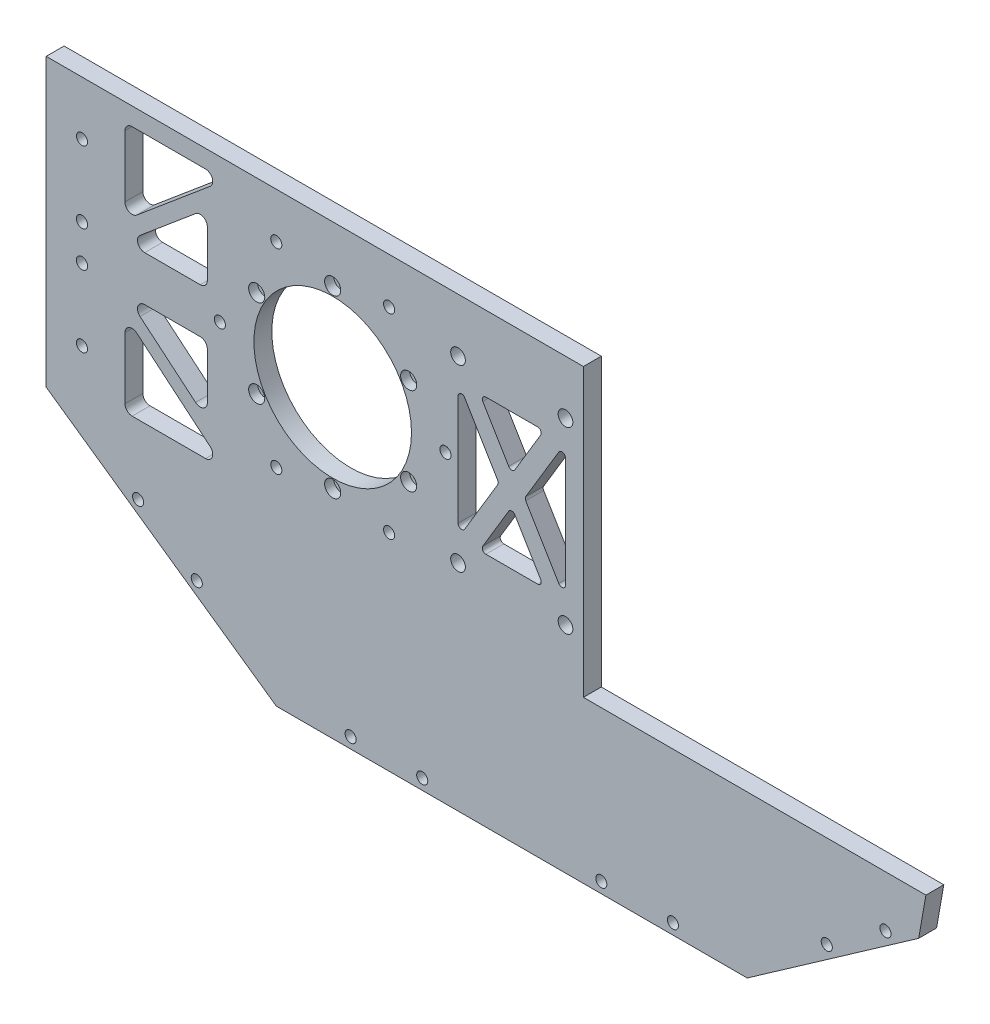
from build123d import *

# Parameters (mm, degrees)
SKETCH_1_W             = 150
SKETCH_1_H             = 80
SKETCH_1_R             = 1.3
SKETCH_1_R_2           = 22
EXTRUDE_1_DEPTH        = 5
SKETCH_3_R             = 1.55
SKETCH_3_R_2           = 1.582849294
CUT_EXTRUDE_3_DEPTH    = 12.5
CUT_EXTRUDE_5_DEPTH    = 8
FILLET_3_R             = 2
FILLET_3_OF_MIRROR_2_R = 2
EXTRUDE_4_DEPTH        = 5
FILLET_5_R             = 5
SKETCH_11_R            = 1.55
CUT_EXTRUDE_7_DEPTH    = 25
SKETCH_12_R            = 2.05
CUT_EXTRUDE_8_DEPTH    = 10
CUT_EXTRUDE_9_DEPTH    = 10
FILLET_6_R             = 1
EXTRUDE_5_DEPTH        = 5
CHAMFER_1_SIZE         = 20
CHAMFER_1_SIZE2        = 14.360300861
SKETCH_16_R            = 1.55
CUT_EXTRUDE_11_DEPTH   = 10.5
SKETCH_17_R            = 2.25
CUT_EXTRUDE_12_DEPTH   = 2.5
CUT_EXTRUDE_13_DEPTH   = 10
SKETCH_19_R            = 1.55
CUT_EXTRUDE_14_DEPTH   = 13


with BuildPart() as part:
    # 草图1 → 凸台-拉伸1 (new body)
    with BuildSketch(Plane.XY):
        with Locations((-5, 0)):
            Rectangle(SKETCH_1_W, SKETCH_1_H)
        with Locations((0, -24.5)):
            Circle(SKETCH_1_R, mode=Mode.SUBTRACT)
        with Locations((-21.217622393, -12.25)):
            Circle(SKETCH_1_R, mode=Mode.SUBTRACT)
        with Locations((-21.217622393, 12.25)):
            Circle(SKETCH_1_R, mode=Mode.SUBTRACT)
        Circle(SKETCH_1_R_2, mode=Mode.SUBTRACT)
        with Locations((0, 24.5)):
            Circle(SKETCH_1_R, mode=Mode.SUBTRACT)
        with Locations((21.217622393, 12.25)):
            Circle(SKETCH_1_R, mode=Mode.SUBTRACT)
        with Locations((21.217622393, -12.25)):
            Circle(SKETCH_1_R, mode=Mode.SUBTRACT)
    extrude(amount=EXTRUDE_1_DEPTH)

    # 草图3 → 切除-拉伸3 (cut)
    with BuildSketch(Plane.XY.offset(5)):
        with Locations((-70, -25)):
            Circle(SKETCH_3_R)
        with Locations((-70, -5)):
            Circle(SKETCH_3_R_2)
        with Locations((-70, 25)):
            Circle(SKETCH_3_R)
        with Locations((-70, 5)):
            Circle(SKETCH_3_R_2)
    extrude(amount=-CUT_EXTRUDE_3_DEPTH, mode=Mode.SUBTRACT)

    # 草图4 → 切除-拉伸5 (cut)
    with BuildSketch(Plane.XY.offset(5)):
        Polygon((-58, 35), (-30, 35), (-58, 11.505210327), align=None)
        Polygon((-35, 25.582872687), (-58, 6.28358117), (-35, 6.28358117), align=None)
    cut_extrude_5 = extrude(amount=-CUT_EXTRUDE_5_DEPTH, mode=Mode.SUBTRACT)

    # 圆角3
    fillet_3_edges = [part.edges().sort_by_distance(p)[0] for p in [
        (-35, 6.28358117, 2.5),
        (-58, 6.28358117, 2.5),
        (-35, 25.582872687, 2.5),
        (-30, 35, 2.5),
        (-58, 11.505210327, 2.5),
        (-58, 35, 2.5),
    ]]
    fillet(fillet_3_edges, radius=FILLET_3_R)

    # 镜向2: 切除-拉伸5 across plane
    add(cut_extrude_5.mirror(Plane.ZX), mode=Mode.SUBTRACT)

    # 圆角3 of 镜向2
    fillet_3_of_mirror_2_edges = [part.edges().sort_by_distance(p)[0] for p in [
        (-35, -6.28358117, 2.5),
        (-58, -6.28358117, 2.5),
        (-35, -25.582872687, 2.5),
        (-30, -35, 2.5),
        (-58, -11.505210327, 2.5),
        (-58, -35, 2.5),
    ]]
    fillet(fillet_3_of_mirror_2_edges, radius=FILLET_3_OF_MIRROR_2_R)

    # 草图10 → 凸台-拉伸4 (add)
    with BuildSketch(Plane.XY.offset(5)):
        Polygon((-80, -40), (-127.053079228, -7.053079228), (-80, 40), align=None)
    extrude(amount=-EXTRUDE_4_DEPTH)

    # 圆角5
    fillet_5_edges = [part.edges().sort_by_distance(p)[0] for p in [
        (-127.053079228, -7.053079228, 2.5),
    ]]
    fillet(fillet_5_edges, radius=FILLET_5_R)

    # 草图11 → 切除-拉伸7 (cut)
    with BuildSketch(Plane.XY.offset(5)):
        with Locations((-15.75, 27.279800219)):
            Circle(SKETCH_11_R)
        with Locations((15.75, 27.279800219)):
            Circle(SKETCH_11_R)
        with Locations((31.5, 0)):
            Circle(SKETCH_11_R)
        with Locations((15.75, -27.279800219)):
            Circle(SKETCH_11_R)
        with Locations((-15.75, -27.279800219)):
            Circle(SKETCH_11_R)
        with Locations((-31.5, 0)):
            Circle(SKETCH_11_R)
    extrude(amount=-CUT_EXTRUDE_7_DEPTH, mode=Mode.SUBTRACT)

    # 草图12 → 切除-拉伸8 (cut)
    with BuildSketch(Plane.XY.offset(5)):
        with Locations((35, 25)):
            Circle(SKETCH_12_R)
        with Locations((65, 25)):
            Circle(SKETCH_12_R)
        with Locations((65, -25)):
            Circle(SKETCH_12_R)
        with Locations((35, -25)):
            Circle(SKETCH_12_R)
    extrude(amount=-CUT_EXTRUDE_8_DEPTH, mode=Mode.SUBTRACT)

    # 草图13 → 切除-拉伸9 (cut)
    with BuildSketch(Plane.XY.offset(5)):
        Polygon((35, 19), (35, -19), (46.4, 0), align=None)
        Polygon((65, -19), (53.6, 0), (65, 19), align=None)
        Polygon((41, 19), (50, 4), (59, 19), align=None)
        Polygon((50, -4), (59, -19), (41, -19), align=None)
    extrude(amount=-CUT_EXTRUDE_9_DEPTH, mode=Mode.SUBTRACT)

    # 圆角6
    fillet_6_edges = [part.edges().sort_by_distance(p)[0] for p in [
        (41, 19, 2.5),
        (59, 19, 2.5),
        (50, 4, 2.5),
        (65, 19, 2.5),
        (65, -19, 2.5),
        (53.6, 0, 2.5),
        (41, -19, 2.5),
        (50, -4, 2.5),
        (59, -19, 2.5),
        (35, 19, 2.5),
        (46.4, 0, 2.5),
        (35, -19, 2.5),
    ]]
    fillet(fillet_6_edges, radius=FILLET_6_R)

    # 草图15 → 凸台-拉伸5 (add)
    with BuildSketch(Plane(origin=(0, 0, 0), x_dir=(-1, 0, 0), z_dir=(0, 0, -1))):
        Polygon((15.733339697, -85), (80, -40), (-50, -40), (-50, -85), align=None)
        Polygon((-50, -85), (-50, -40), (-180, -40), (-115.733339697, -85), align=None)
    extrude(amount=-EXTRUDE_5_DEPTH)

    # 倒角1
    chamfer_1_edges = [part.edges().sort_by_distance(p)[0] for p in [
        (180, -40, 2.5),
    ]]
    chamfer_1_side = [part.faces().sort_by_distance(p)[0] for p in [
        (147.866669848, -62.5, 2.5),
    ]]
    chamfer(chamfer_1_edges, length=CHAMFER_1_SIZE, length2=CHAMFER_1_SIZE2, reference=chamfer_1_side[0])

    # 草图16 → 切除-拉伸11 (cut)
    with BuildSketch(Plane(origin=(0, 0, 0), x_dir=(-1, 0, 0), z_dir=(0, 0, -1))):
        with Locations((-95, -82)):
            Circle(SKETCH_16_R)
        with Locations((-75, -82)):
            Circle(SKETCH_16_R)
        with Locations((-25, -82)):
            Circle(SKETCH_16_R)
        with Locations((-5, -82)):
            Circle(SKETCH_16_R)
    extrude(amount=-CUT_EXTRUDE_11_DEPTH, mode=Mode.SUBTRACT)

    # 草图17 → 切除-拉伸12 (cut)
    with BuildSketch(Plane.XY.offset(5)):
        with Locations((0, 24.5)):
            Circle(SKETCH_17_R)
        with Locations((21.217622393, 12.25)):
            Circle(SKETCH_17_R)
        with Locations((21.217622393, -12.25)):
            Circle(SKETCH_17_R)
        with Locations((0, -24.5)):
            Circle(SKETCH_17_R)
        with Locations((-21.217622393, -12.25)):
            Circle(SKETCH_17_R)
        with Locations((-21.217622393, 12.25)):
            Circle(SKETCH_17_R)
    extrude(amount=-CUT_EXTRUDE_12_DEPTH, mode=Mode.SUBTRACT)

    # 草图18 → 切除-拉伸13 (cut)
    with BuildSketch(Plane(origin=(0, 0, 0), x_dir=(-1, 0, 0), z_dir=(0, 0, -1))):
        with BuildLine():
            Line((80, -40), (122.17194227, -10.470888122))
            ThreePointArc((122.17194227, -10.470888122), (124.285033579, -6.810906614), (122.839593994, -2.839593994))
            Line((122.839593994, -2.839593994), (80, 40))
            Line((80, 40), (80, 0))
            Line((80, 0), (80, -40))
        make_face()
    extrude(amount=-CUT_EXTRUDE_13_DEPTH, mode=Mode.SUBTRACT)

    # 草图19 → 切除-拉伸14 (cut)
    with BuildSketch(Plane.XY.offset(5)):
        with Locations((-54.337460982, -54.306779504)):
            Circle(SKETCH_19_R)
        with Locations((-37.954420096, -65.778308231)):
            Circle(SKETCH_19_R)
        with Locations((137.954420096, -65.778308231)):
            Circle(SKETCH_19_R)
        with Locations((154.337460982, -54.306779504)):
            Circle(SKETCH_19_R)
    extrude(amount=-CUT_EXTRUDE_14_DEPTH, mode=Mode.SUBTRACT)


solid = part.part
